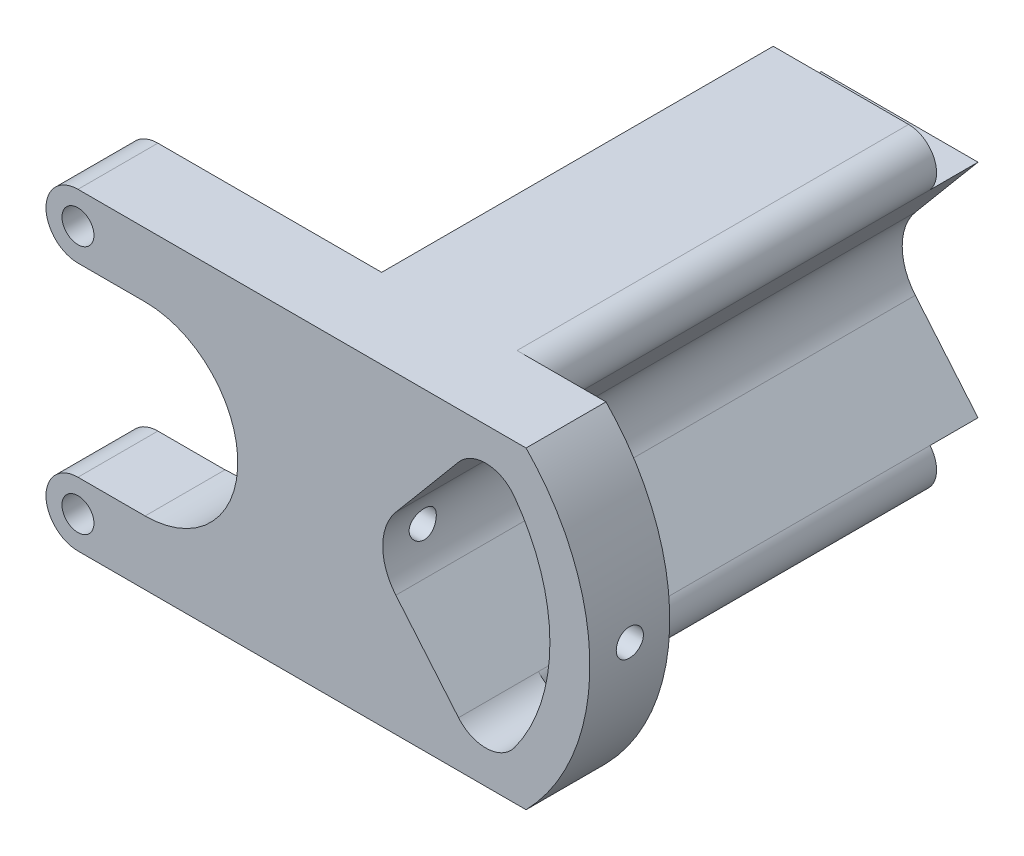
from build123d import *

# Parameters (mm, degrees)
SKETCH_1_R               = 2
EXTRUDE_1_DEPTH          = 10
EXTRUDE_START            = -15
EXTRUDE_2_DEPTH          = 15
EXTRUDE_START_2          = -55
EXTRUDE_3_DEPTH          = 40
CUT_EXTRUDE_1_DEPTH      = 71.775419462
CUT_EXTRUDE_1_DEPTH_BACK = 71.775419462
SKETCH_2_R               = 1.7
SKETCH_2_W               = 6
SKETCH_2_H               = 5.749756634


with BuildPart() as part:
    # 草图1 → 凸台-拉伸1 (new body)
    # profile 1 of 3: a face of its own
    with BuildSketch(Plane.XY):
        with BuildLine():
            Line((3.775539923, 4.499513268), (11.6217341, 13.850243366))
            ThreePointArc((11.6217341, 13.850243366), (12.112655804, 17.579163916), (8.940578549, 19.6))
            Line((8.940578549, 19.6), (-8, 19.6))
            Line((-8, 19.6), (-8, -19.6))
            Line((-8, -19.6), (8.940578549, -19.6))
            ThreePointArc((8.940578549, -19.6), (12.112655804, -17.579163916), (11.6217341, -13.850243366))
            Line((11.6217341, -13.850243366), (3.775539923, -4.499513268))
            ThreePointArc((3.775539923, -4.499513268), (2.137851025, 0), (3.775539923, 4.499513268))
        make_face()
    # profile 2 of 3: a face of its own
    with BuildSketch(Plane.XY):
        with BuildLine():
            Line((-8, -19.6), (-8, 19.6))
            Line((-8, 19.6), (-21.5, 19.6))
            Line((-21.5, 19.6), (-36, 19.6))
            ThreePointArc((-36, 19.6), (-40, 15.6), (-36, 11.6))
            Line((-36, 11.6), (-27.6, 11.6))
            ThreePointArc((-27.6, 11.6), (-16, 0), (-27.6, -11.6))
            Line((-27.6, -11.6), (-36, -11.6))
            ThreePointArc((-36, -11.6), (-40, -15.6), (-36, -19.6))
            Line((-36, -19.6), (-21.5, -19.6))
            Line((-21.5, -19.6), (-8, -19.6))
        make_face()
        with Locations((-36, -15.6)):
            Circle(SKETCH_1_R, mode=Mode.SUBTRACT)
        with Locations((-36, 15.6)):
            Circle(SKETCH_1_R, mode=Mode.SUBTRACT)
    # profile 3 of 3: a face of its own
    with BuildSketch(Plane.XY):
        with BuildLine():
            ThreePointArc((18.601156804, 13.619370123), (15.167616283, 15.432881266), (11.6217341, 13.850243366))
            ThreePointArc((11.6217341, 13.850243366), (12.112655804, 17.579163916), (8.940578549, 19.6))
            Line((8.940578549, 19.6), (20.071646816, 19.6))
            ThreePointArc((20.071646816, 19.6), (28.054072893, 0), (20.071646816, -19.6))
            Line((20.071646816, -19.6), (8.940578549, -19.6))
            ThreePointArc((8.940578549, -19.6), (12.112655804, -17.579163916), (11.6217341, -13.850243366))
            ThreePointArc((11.6217341, -13.850243366), (15.167616283, -15.432881266), (18.601156804, -13.619370123))
            ThreePointArc((18.601156804, -13.619370123), (23.054072893, 0), (18.601156804, 13.619370123))
        make_face()
    extrude(amount=EXTRUDE_1_DEPTH)

    # 草图1<3> → 凸台-拉伸2 (add)
    with BuildSketch(Plane.XY.offset(EXTRUDE_START)):
        with BuildLine():
            Line((3.775539923, 4.499513268), (11.6217341, 13.850243366))
            ThreePointArc((11.6217341, 13.850243366), (12.112655804, 17.579163916), (8.940578549, 19.6))
            Line((8.940578549, 19.6), (-8, 19.6))
            Line((-8, 19.6), (-8, -19.6))
            Line((-8, -19.6), (8.940578549, -19.6))
            ThreePointArc((8.940578549, -19.6), (12.112655804, -17.579163916), (11.6217341, -13.850243366))
            Line((11.6217341, -13.850243366), (3.775539923, -4.499513268))
            ThreePointArc((3.775539923, -4.499513268), (2.137851025, 0), (3.775539923, 4.499513268))
        make_face()
    extrude(amount=EXTRUDE_2_DEPTH)

    # 草图1<4> → 凸台-拉伸3 (add)
    with BuildSketch(Plane.XY.offset(EXTRUDE_START_2)):
        with BuildLine():
            Line((3.775539923, 4.499513268), (11.6217341, 13.850243366))
            ThreePointArc((11.6217341, 13.850243366), (12.112655804, 17.579163916), (8.940578549, 19.6))
            Line((8.940578549, 19.6), (-8, 19.6))
            Line((-8, 19.6), (-8, -19.6))
            Line((-8, -19.6), (8.940578549, -19.6))
            ThreePointArc((8.940578549, -19.6), (12.112655804, -17.579163916), (11.6217341, -13.850243366))
            Line((11.6217341, -13.850243366), (3.775539923, -4.499513268))
            ThreePointArc((3.775539923, -4.499513268), (2.137851025, 0), (3.775539923, 4.499513268))
        make_face()
    extrude(amount=EXTRUDE_3_DEPTH)

    # 草图2 → 切除-拉伸1 (cut, two sides: drawn at the far end of the back side and taken through both)
    with BuildSketch(Plane(origin=(0, 0, 0), x_dir=(0, 0, -1), z_dir=(1, 0, 0)).offset(-CUT_EXTRUDE_1_DEPTH_BACK)):
        with Locations((-5, 0)):
            Circle(SKETCH_2_R)
        with Locations((52, 16.725121683)):
            Rectangle(SKETCH_2_W, SKETCH_2_H)
        with Locations((52, -16.725121683)):
            Rectangle(SKETCH_2_W, SKETCH_2_H)
    extrude(amount=CUT_EXTRUDE_1_DEPTH + CUT_EXTRUDE_1_DEPTH_BACK, mode=Mode.SUBTRACT)


solid = part.part
